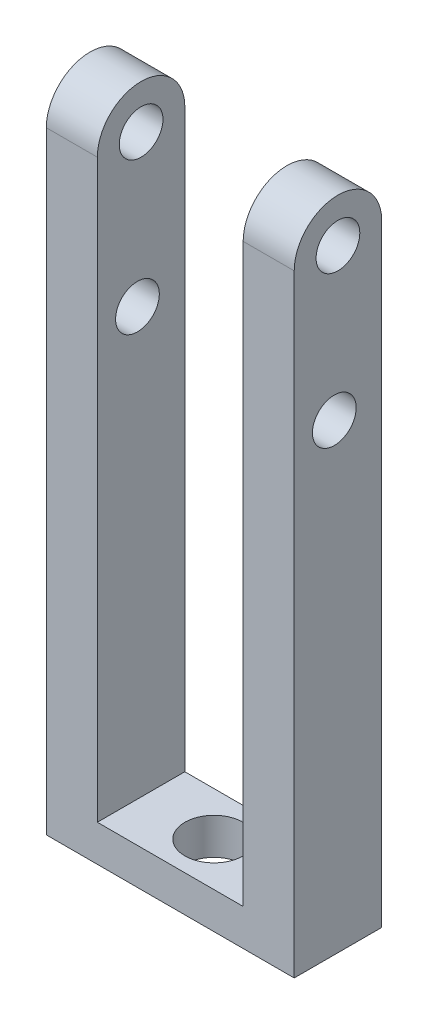
from build123d import *

# Parameters (mm, degrees)
SKETCH1_W           = 34
SKETCH1_H           = 12
BOSS_EXTRUDE1_DEPTH = 5
SKETCH5_R           = 3
BOSS_EXTRUDE3_DEPTH = 7
SKETCH6_R           = 1.5
CUT_EXTRUDE1_DEPTH  = 3
SKETCH8_R           = 4
CUT_EXTRUDE4_DEPTH  = 87.890735985


with BuildPart() as part:
    # Sketch1 → Boss-Extrude1 (new body)
    with BuildSketch(Plane(origin=(0, 0, 0), x_dir=(1, 0, 0), z_dir=(0, 1, 0))):
        Rectangle(SKETCH1_W, SKETCH1_H)
    extrude(amount=BOSS_EXTRUDE1_DEPTH)

    # Sketch5 → Boss-Extrude3 (add)
    with BuildSketch(Plane(origin=(17, 0, 0), x_dir=(0, 0, -1), z_dir=(1, 0, 0))):
        with BuildLine():
            Line((-6, 5), (6, 5))
            Line((6, 5), (6, 84))
            ThreePointArc((6, 84), (0, 90), (-6, 84))
            Line((-6, 84), (-6, 5))
        make_face()
        with Locations((0, 84)):
            Circle(SKETCH5_R, mode=Mode.SUBTRACT)
        with Locations((-0.5, 63.5)):
            Circle(SKETCH5_R, mode=Mode.SUBTRACT)
    boss_extrude3 = extrude(amount=-BOSS_EXTRUDE3_DEPTH)

    # Sketch6 → Cut-Extrude1 (cut)
    with BuildSketch(Plane(origin=(0, 5, 0), x_dir=(1, 0, 0), z_dir=(0, 1, 0))):
        with Locations(Location((0, 0, 0), (0, 0, 270))):
            Circle(SKETCH6_R)
    extrude(amount=-CUT_EXTRUDE1_DEPTH, mode=Mode.SUBTRACT)

    # Sketch8 → Cut-Extrude4 (cut, through all)
    with BuildSketch(Plane(origin=(0, 5, 0), x_dir=(1, 0, 0), z_dir=(0, 1, 0))):
        with Locations(Location((0, 0, 0), (0, 0, 270))):
            Circle(SKETCH8_R)
    extrude(amount=-CUT_EXTRUDE4_DEPTH, mode=Mode.SUBTRACT)

    # Mirror1: Boss-Extrude3 across plane
    add(boss_extrude3.mirror(Plane(origin=(0, 0, 0), x_dir=(0, 0, 1), z_dir=(1, 0, 0))))


solid = part.part
